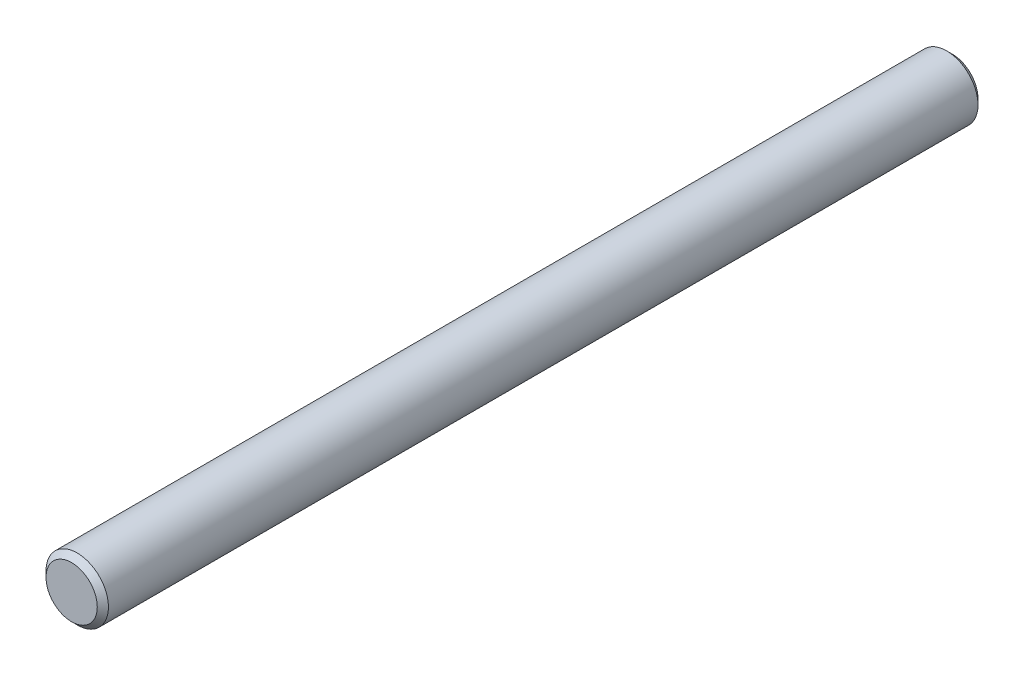
from build123d import *

# Parameters (mm, degrees)
SKETCH1_R           = 2.8
BOSS_EXTRUDE1_DEPTH = 79
CHAMFER1_SIZE       = 0.5


with BuildPart() as part:
    # Sketch1 → Boss-Extrude1 (new body)
    with BuildSketch(Plane.XY):
        Circle(SKETCH1_R)
    extrude(amount=-BOSS_EXTRUDE1_DEPTH)

    # Chamfer1
    chamfer1_edges = [part.edges().sort_by_distance(p)[0] for p in [
        (-2.8, 0, 0),
        (-2.8, 0, -79),
    ]]
    chamfer(chamfer1_edges, length=CHAMFER1_SIZE)


solid = part.part
